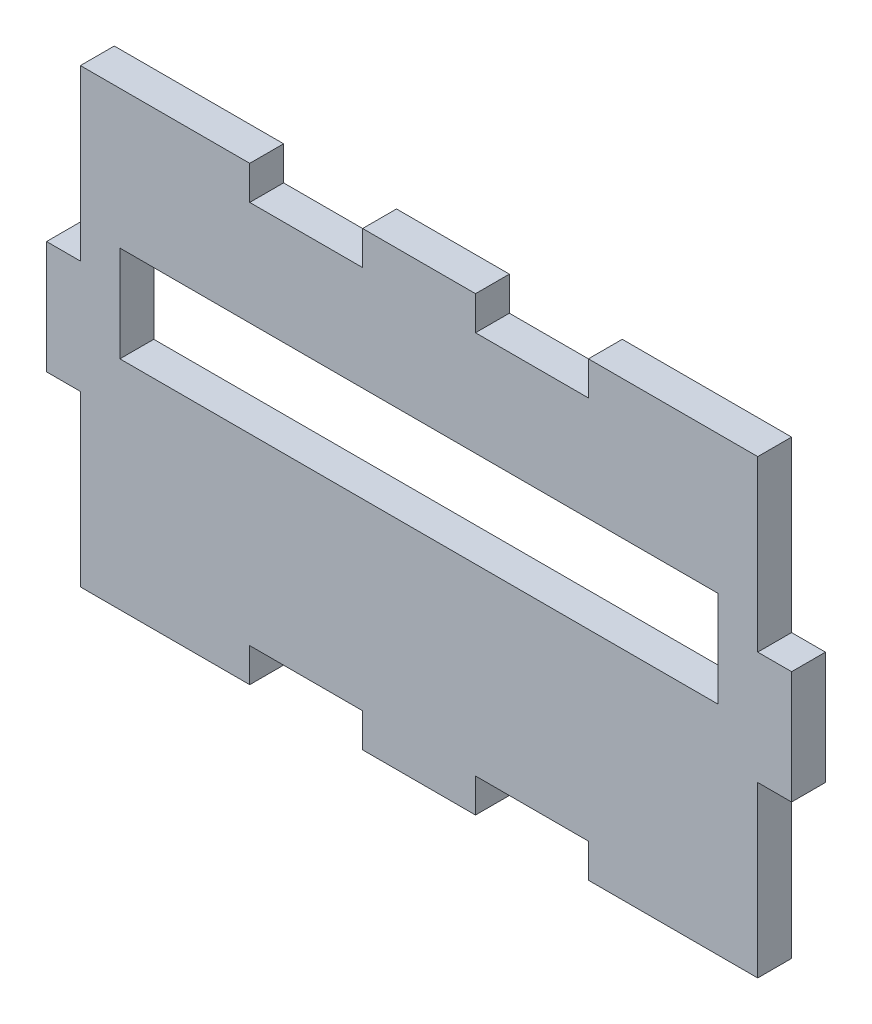
from build123d import *

# Parameters (mm, degrees)
ESBO_O1_W                = 106
ESBO_O1_H                = 17
RESSALTO_EXTRUS_O6_DEPTH = 6


with BuildPart() as part:
    # Esboço1 → Ressalto-extrusão6 (new body)
    with BuildSketch(Plane.XY):
        Polygon((-89.999999416, 0), (-89.999999416, 6), (-69.999999416, 6), (-69.999999416, 0), (-50.000075213, 0), (-50.000075213, 6), (-30.000075213, 6), (-30.000075213, 0), (0, 0), (0, 30), (6, 30), (6, 50), (0, 50), (0, 80), (-30.000000584, 80), (-30.000000584, 74), (-50.000000584, 74), (-50, 80), (-70, 80), (-70, 74), (-90, 74), (-89.999999416, 80), (-120, 80), (-120, 50), (-126, 50), (-126, 30), (-120, 30), (-120, 0), align=None)
        with Locations((-60, 47)):
            Rectangle(ESBO_O1_W, ESBO_O1_H, mode=Mode.SUBTRACT)
    extrude(amount=RESSALTO_EXTRUS_O6_DEPTH)


solid = part.part
